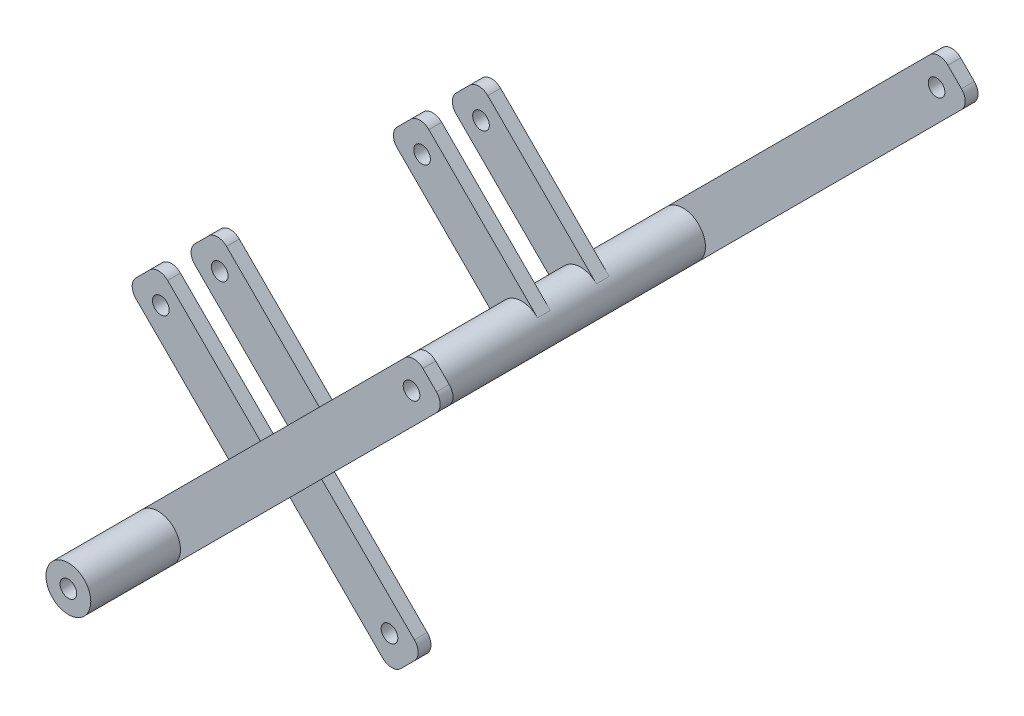
from build123d import *

# Parameters (mm, degrees)
SKETCH1_R               = 17.5
SKETCH1_R_2             = 6.5
BOSS_EXTRUDE1_DEPTH     = 280
SKETCH2_R               = 6.5
BOSS_EXTRUDE2_DEPTH     = 10
SKETCH3_R               = 6.5
BOSS_EXTRUDE3_DEPTH     = 10
MIRROR3_COPY_1_SKETCH_R = 6.5
MIRROR3_COPY_1_DEPTH    = 10
SKETCH4_R               = 6.5
BOSS_EXTRUDE4_DEPTH     = 5


with BuildPart() as part:
    # Sketch1 → Boss-Extrude1 (new, symmetric)
    with BuildSketch(Plane.XY):
        Circle(SKETCH1_R)
        Circle(SKETCH1_R_2, mode=Mode.SUBTRACT)
    extrude(amount=BOSS_EXTRUDE1_DEPTH, both=True)

    # Sketch2 → Boss-Extrude2 (add)
    with BuildSketch(Plane.XY.offset(210)):
        with BuildLine():
            Line((-12.374368671, 12.374368671), (192.686597873, 217.435335215))
            ThreePointArc((192.686597873, 217.435335215), (199.757665685, 220.364267403), (206.828733497, 217.435335215))
            Line((206.828733497, 217.435335215), (217.435335215, 206.828733497))
            ThreePointArc((217.435335215, 206.828733497), (220.364267403, 199.757665685), (217.435335215, 192.686597873))
            Line((217.435335215, 192.686597873), (12.374368671, -12.374368671))
            ThreePointArc((12.374368671, -12.374368671), (12.374368671, 12.374368671), (-12.374368671, 12.374368671))
        make_face()
        with Locations((197.989898732, 197.989898732)):
            Circle(SKETCH2_R, mode=Mode.SUBTRACT)
    boss_extrude2 = extrude(amount=-BOSS_EXTRUDE2_DEPTH)

    # Mirror1: Boss-Extrude2 across plane
    add(boss_extrude2.mirror(Plane.XY))

    # Sketch3 → Boss-Extrude3 (add)
    with BuildSketch(Plane.XY.offset(130)):
        with BuildLine():
            Line((12.374368671, 12.374368671), (-72.478445072, 97.227182413))
            ThreePointArc((-72.478445072, 97.227182413), (-79.549512883, 100.156114601), (-86.620580695, 97.227182413))
            Line((-86.620580695, 97.227182413), (-97.227182413, 86.620580695))
            ThreePointArc((-97.227182413, 86.620580695), (-100.156114601, 79.549512883), (-97.227182413, 72.478445072))
            Line((-97.227182413, 72.478445072), (-12.374368671, -12.374368671))
            ThreePointArc((-12.374368671, -12.374368671), (-12.374368671, 12.374368671), (12.374368671, 12.374368671))
        make_face()
        with Locations((-77.781745931, 77.781745931)):
            Circle(SKETCH3_R, mode=Mode.SUBTRACT)
    boss_extrude3 = extrude(amount=-BOSS_EXTRUDE3_DEPTH)

    # Mirror2: Boss-Extrude3 across plane
    add(boss_extrude3.mirror(Plane(origin=(0, 0, 102), x_dir=(1, 0, 0), z_dir=(0, 0, -1))))

    # Mirror3: Boss-Extrude3 across plane
    add(boss_extrude3.mirror(Plane.XY))

    # Mirror3 copy 1 sketch → Mirror3 copy 1 (add)
    with BuildSketch(Plane.XY.offset(-74)):
        with BuildLine():
            Line((12.374368671, 12.374368671), (-72.478445072, 97.227182413))
            ThreePointArc((-72.478445072, 97.227182413), (-79.549512883, 100.156114601), (-86.620580695, 97.227182413))
            Line((-86.620580695, 97.227182413), (-97.227182413, 86.620580695))
            ThreePointArc((-97.227182413, 86.620580695), (-100.156114601, 79.549512883), (-97.227182413, 72.478445072))
            Line((-97.227182413, 72.478445072), (-12.374368671, -12.374368671))
            ThreePointArc((-12.374368671, -12.374368671), (-12.374368671, 12.374368671), (12.374368671, 12.374368671))
        make_face()
        with Locations((-77.781745931, 77.781745931)):
            Circle(MIRROR3_COPY_1_SKETCH_R, mode=Mode.SUBTRACT)
    extrude(amount=-MIRROR3_COPY_1_DEPTH)

    # Sketch4 → Boss-Extrude4 (add, symmetric)
    with BuildSketch(Plane(origin=(0, 0, 102), x_dir=(-1, 0, 0), z_dir=(0, 0, -1))):
        with BuildLine():
            Line((-12.374368671, 12.374368671), (-97.227182413, -72.478445072))
            ThreePointArc((-97.227182413, -72.478445072), (-100.156114601, -79.549512883), (-97.227182413, -86.620580695))
            Line((-97.227182413, -86.620580695), (-86.620580695, -97.227182413))
            ThreePointArc((-86.620580695, -97.227182413), (-79.549512883, -100.156114601), (-72.478445072, -97.227182413))
            Line((-72.478445072, -97.227182413), (12.374368671, -12.374368671))
            ThreePointArc((12.374368671, -12.374368671), (-12.374368671, -12.374368671), (-12.374368671, 12.374368671))
        make_face()
        with Locations((-77.781745931, -77.781745931)):
            Circle(SKETCH4_R, mode=Mode.SUBTRACT)
    extrude(amount=BOSS_EXTRUDE4_DEPTH, both=True)


solid = part.part
